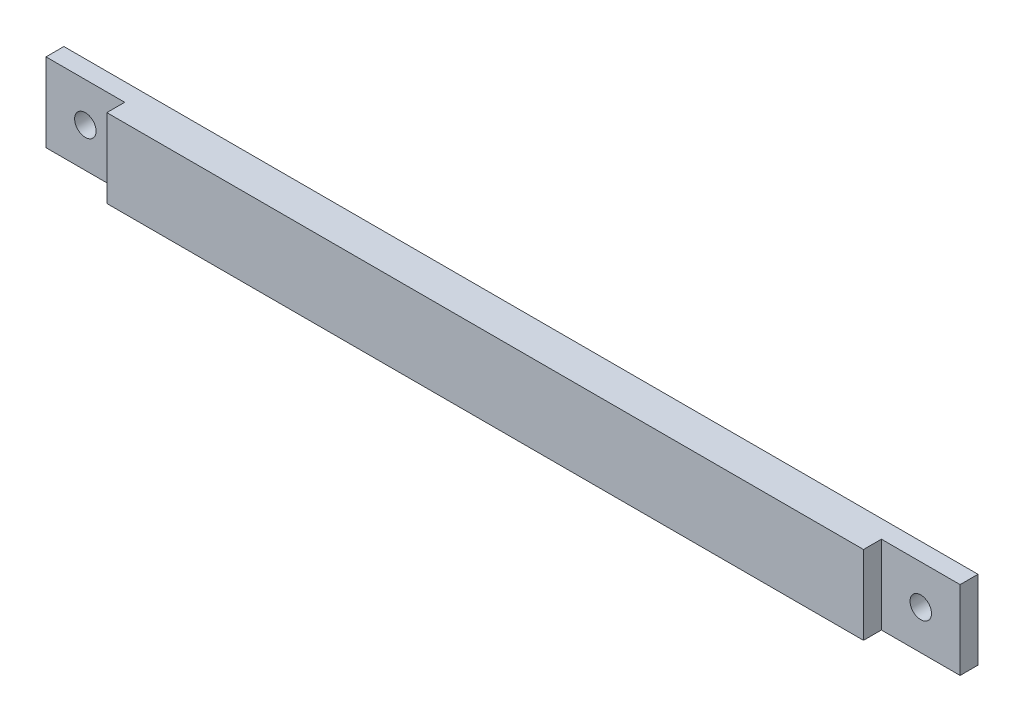
from build123d import *

# Parameters (mm, degrees)
ESQUISSE1_W             = 255.49
ESQUISSE1_H             = 22
ESQUISSE1_R             = 3
BOSS_EXTRU_1_DEPTH      = 10
ESQUISSE2_W             = 22
ESQUISSE2_H             = 22
ENL_V_MAT_EXTRU_1_DEPTH = 5


with BuildPart() as part:
    # Esquisse1 → Boss.-Extru.1 (new body)
    with BuildSketch(Plane.XY):
        with Locations((-10.977028198, 42.888888889)):
            Rectangle(ESQUISSE1_W, ESQUISSE1_H)
        with Locations((-127.722028198, 42.888888889)):
            Circle(ESQUISSE1_R, mode=Mode.SUBTRACT)
        with Locations((105.767971802, 42.888888889)):
            Circle(ESQUISSE1_R, mode=Mode.SUBTRACT)
    extrude(amount=BOSS_EXTRU_1_DEPTH)

    # Esquisse2 → Enlèv. mat.-Extru.1 (cut)
    with BuildSketch(Plane.XY.offset(10)):
        with Locations((-127.722028198, 42.888888889)):
            Rectangle(ESQUISSE2_W, ESQUISSE2_H)
        with Locations((105.767971802, 42.888888889)):
            Rectangle(ESQUISSE2_W, ESQUISSE2_H)
    extrude(amount=-ENL_V_MAT_EXTRU_1_DEPTH, mode=Mode.SUBTRACT)


solid = part.part
